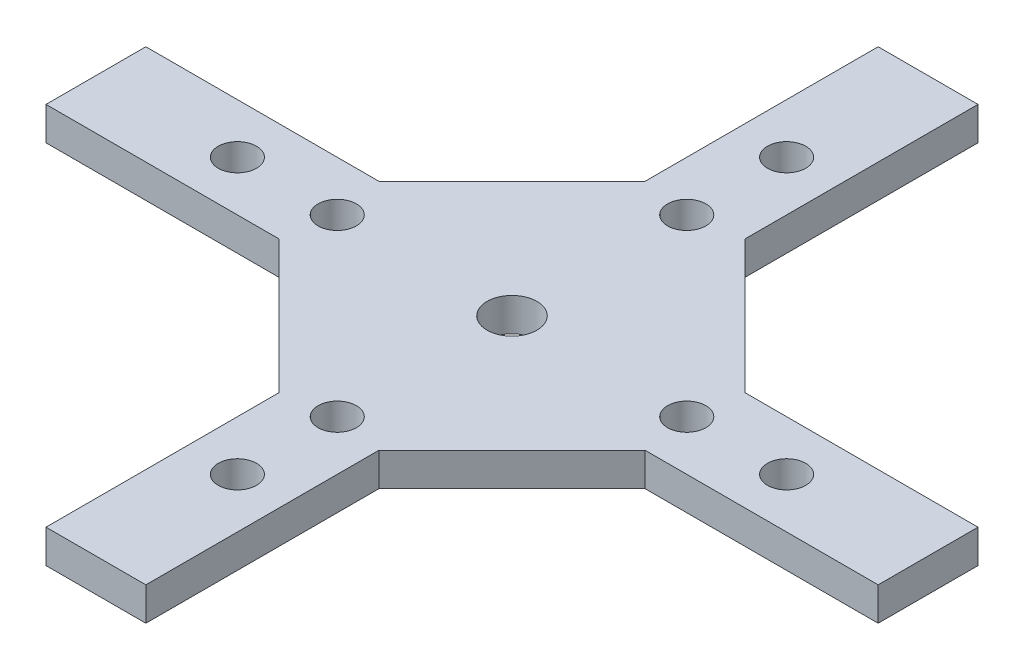
from build123d import *

# Parameters (mm, degrees)
SKETCH_1_W          = 22
SKETCH_1_H          = 6
SKETCH_1_W_2        = 6
SKETCH_1_H_2        = 22
SKETCH_1_R          = 1.5
EXTRUDE_1_DEPTH     = 2
SKETCH_2_R          = 1.15
CUT_EXTRUDE_1_DEPTH = 12
CHAMFER_1_SIZE      = 8


with BuildPart() as part:
    # 草图1 → 凸台-拉伸1 (new body)
    # profile 1 of 5: a face of its own
    with BuildSketch(Plane(origin=(0, 0, 0), x_dir=(1, 0, 0), z_dir=(0, 1, 0))):
        with Locations((-14, 0)):
            Rectangle(SKETCH_1_W, SKETCH_1_H)
    # profile 2 of 5: a face of its own
    with BuildSketch(Plane(origin=(0, 0, 0), x_dir=(1, 0, 0), z_dir=(0, 1, 0))):
        with Locations((14, 0)):
            Rectangle(SKETCH_1_W, SKETCH_1_H)
    # profile 3 of 5: a face of its own
    with BuildSketch(Plane(origin=(0, 0, 0), x_dir=(1, 0, 0), z_dir=(0, 1, 0))):
        with Locations((0, 14)):
            Rectangle(SKETCH_1_W_2, SKETCH_1_H_2)
    # profile 4 of 5: a face of its own
    with BuildSketch(Plane(origin=(0, 0, 0), x_dir=(1, 0, 0), z_dir=(0, 1, 0))):
        with Locations((0, -14)):
            Rectangle(SKETCH_1_W_2, SKETCH_1_H_2)
    # profile 5 of 5: a face of its own
    with BuildSketch(Plane(origin=(0, 0, 0), x_dir=(1, 0, 0), z_dir=(0, 1, 0))):
        Rectangle(SKETCH_1_W_2, SKETCH_1_H)
        with Locations(Location((0, 0, 0), (0, 0, 270))):
            Circle(SKETCH_1_R, mode=Mode.SUBTRACT)
    extrude(amount=EXTRUDE_1_DEPTH)

    # 草图2 → 切除-拉伸1 (cut)
    with BuildSketch(Plane(origin=(0, 2, 0), x_dir=(1, 0, 0), z_dir=(0, 1, 0))):
        with Locations(Location((0, 10.5, 0), (0, 0, 270))):
            Circle(SKETCH_2_R)
        with Locations(Location((0, 16.5, 0), (0, 0, 270))):
            Circle(SKETCH_2_R)
        with Locations(Location((16.5, 0, 0), (0, 0, 270))):
            Circle(SKETCH_2_R)
        with Locations(Location((10.5, 0, 0), (0, 0, 270))):
            Circle(SKETCH_2_R)
        with Locations(Location((0, -16.5, 0), (0, 0, 270))):
            Circle(SKETCH_2_R)
        with Locations(Location((0, -10.5, 0), (0, 0, 270))):
            Circle(SKETCH_2_R)
        with Locations(Location((-16.5, 0, 0), (0, 0, 270))):
            Circle(SKETCH_2_R)
        with Locations(Location((-10.5, 0, 0), (0, 0, 270))):
            Circle(SKETCH_2_R)
    extrude(amount=-CUT_EXTRUDE_1_DEPTH, mode=Mode.SUBTRACT)

    # 倒角1
    chamfer_1_edges = [part.edges().sort_by_distance(p)[0] for p in [
        (-3, 1, -3),
        (3, 1, -3),
        (3, 1, 3),
        (-3, 1, 3),
    ]]
    chamfer(chamfer_1_edges, length=CHAMFER_1_SIZE)


solid = part.part
